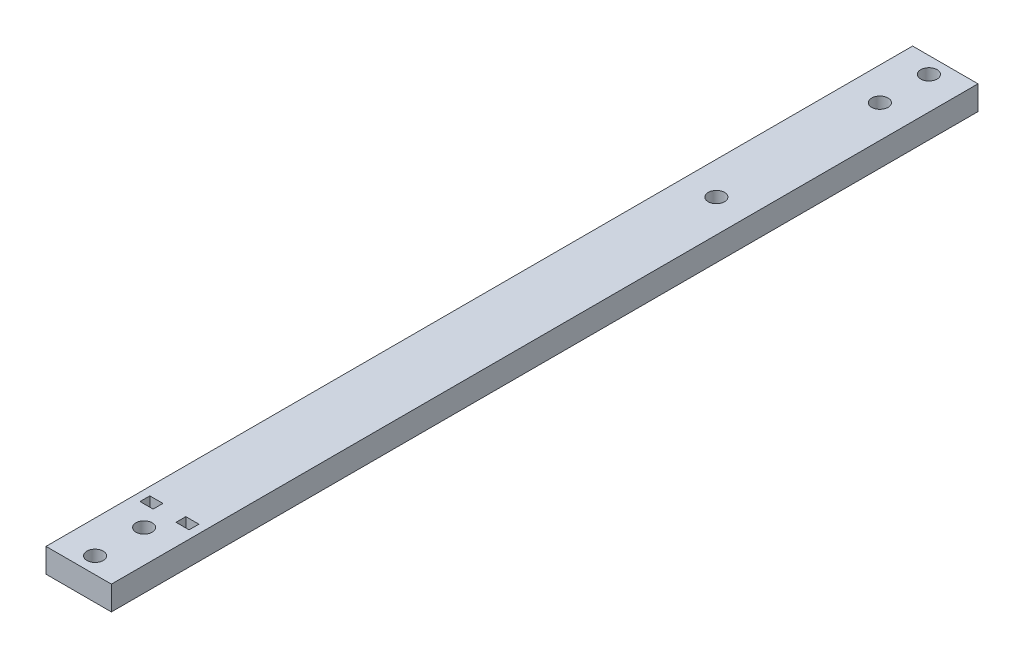
from build123d import *

# Parameters (mm, degrees)
SKETCH_1_W          = 8
SKETCH_1_H          = 106
EXTRUDE_1_DEPTH     = 2.95
SKETCH_2_R          = 0.7
CUT_EXTRUDE_1_DEPTH = 107.342383366
SKETCH_2_3_R        = 1
CUT_EXTRUDE_2_DEPTH = 1.5
SKETCH_3_W          = 1.6
SKETCH_3_H          = 1.2
CUT_EXTRUDE_3_DEPTH = 107.342383366


with BuildPart() as part:
    # 草图1 → 凸台-拉伸1 (new body)
    with BuildSketch(Plane(origin=(0, 0, 0), x_dir=(1, 0, 0), z_dir=(0, 1, 0))):
        with Locations((4, -53)):
            Rectangle(SKETCH_1_W, SKETCH_1_H)
    extrude(amount=EXTRUDE_1_DEPTH)

    # 草图2 → 切除-拉伸1 (cut, through all)
    with BuildSketch(Plane(origin=(0, 2.95, 0), x_dir=(1, 0, 0), z_dir=(0, 1, 0))):
        with Locations((4, -8)):
            Circle(SKETCH_2_R)
        with Locations((4, -2)):
            Circle(SKETCH_2_R)
        with Locations((4, -104)):
            Circle(SKETCH_2_R)
        with Locations((4, -98)):
            Circle(SKETCH_2_R)
        with Locations((4, -28)):
            Circle(SKETCH_2_R)
    extrude(amount=-CUT_EXTRUDE_1_DEPTH, mode=Mode.SUBTRACT)

    # 草图2<3> → 切除-拉伸2 (cut)
    with BuildSketch(Plane(origin=(0, 2.95, 0), x_dir=(1, 0, 0), z_dir=(0, 1, 0))):
        with Locations((4, -8)):
            Circle(SKETCH_2_3_R)
        with Locations((4, -2)):
            Circle(SKETCH_2_3_R)
        with Locations((4, -104)):
            Circle(SKETCH_2_3_R)
        with Locations((4, -98)):
            Circle(SKETCH_2_3_R)
        with Locations((4, -28)):
            Circle(SKETCH_2_3_R)
    extrude(amount=-CUT_EXTRUDE_2_DEPTH, mode=Mode.SUBTRACT)

    # 草图3 → 切除-拉伸3 (cut, through all)
    with BuildSketch(Plane(origin=(0, 2.95, 0), x_dir=(1, 0, 0), z_dir=(0, 1, 0))):
        with Locations((1.8, -94.9)):
            Rectangle(SKETCH_3_W, SKETCH_3_H)
        with Locations((6.2, -94.9)):
            Rectangle(SKETCH_3_W, SKETCH_3_H)
    extrude(amount=-CUT_EXTRUDE_3_DEPTH, mode=Mode.SUBTRACT)


solid = part.part
